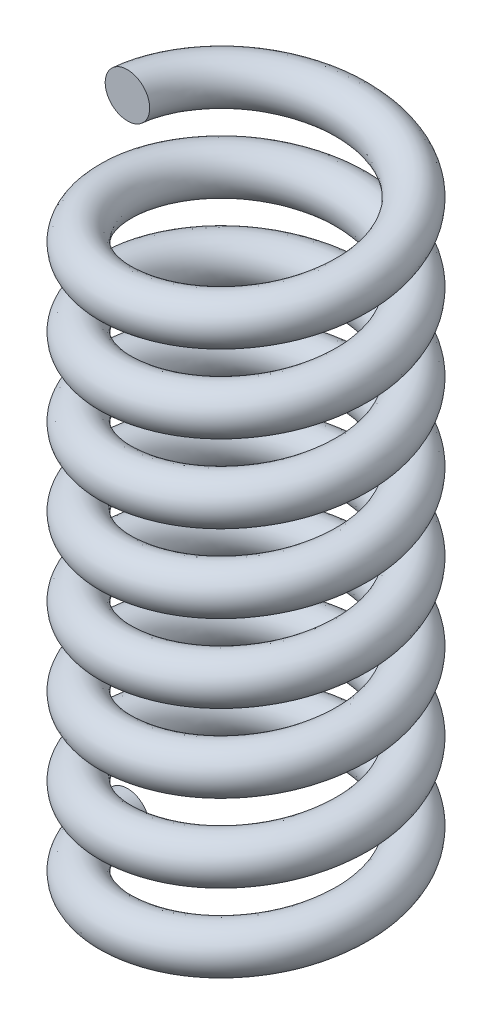
from build123d import *

# Parameters (mm, degrees)
SWEEP1_PITCH       = 2.625
SWEEP1_HEIGHT      = 21
SWEEP1_RADIUS      = 4
SWEEP1_START_ANGLE = -90
SKETCH3_R          = 0.75


with BuildPart() as part:
    # Sweep1: sweep along a helix
    with BuildLine() as sweep1_path:
        add(Helix(SWEEP1_PITCH, SWEEP1_HEIGHT, SWEEP1_RADIUS, center=(0, 0, 0), direction=(0, 1, 0), mode=Mode.PRIVATE).rotate(Axis((0, 0, 0), (0, 1, 0)), SWEEP1_START_ANGLE))
    # Sketch3 → Sweep1 (sweep)
    with BuildSketch(Plane.XY):
        with Locations((-4, 0)):
            Circle(SKETCH3_R)
    sweep(path=sweep1_path.line, is_frenet=True)


solid = part.part
